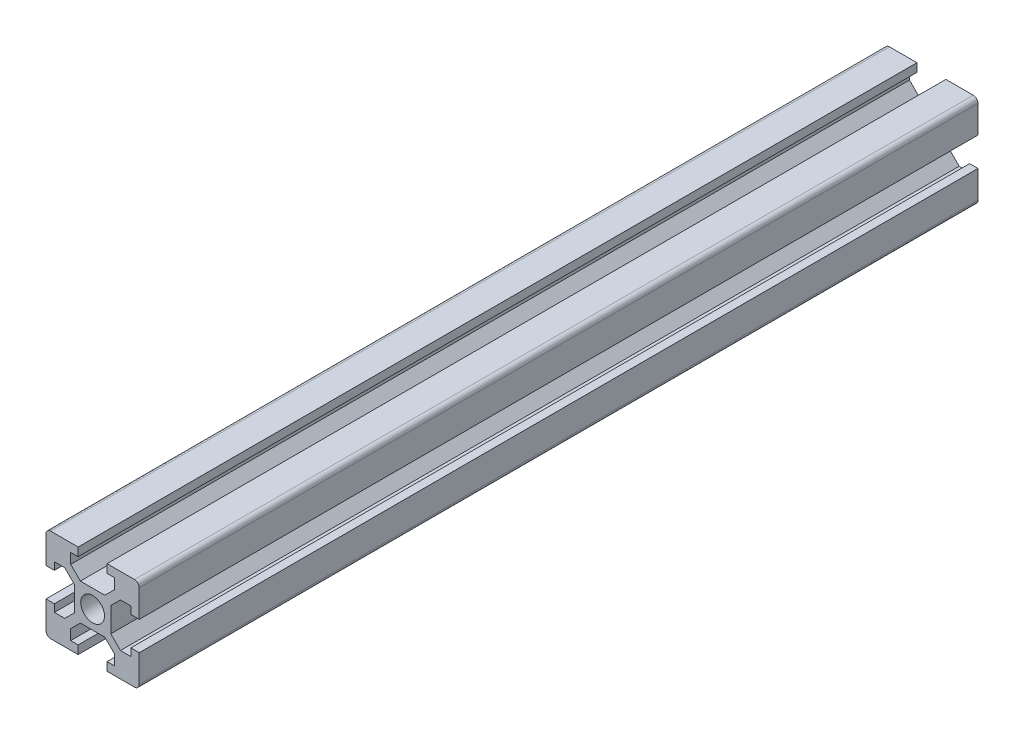
from build123d import *

# Parameters (mm, degrees)
SKETCH_1_R      = 2.55
EXTRUDE_1_DEPTH = 180
FILLET_1_R      = 1


with BuildPart() as part:
    # 草图1 → 凸台-拉伸1 (new body)
    with BuildSketch(Plane.XY):
        Polygon((4.62194142, 1.905266374), (6.694733626, 3.97805858), (6.694733626, 6.205266374), (5.094733626, 6.205266374), (5.094733626, 8.005266374), (11.994733626, 8.005266374), (11.994733626, 1.105266374), (10.194733626, 1.105266374), (10.194733626, 2.705266374), (7.967525833, 2.705266374), (5.894733626, 0.632474167), (5.894733626, -4.62194142), (7.967525833, -6.694733626), (10.194733626, -6.694733626), (10.194733626, -5.094733626), (11.994733626, -5.094733626), (11.994733626, -11.994733626), (5.094733626, -11.994733626), (5.094733626, -10.194733626), (6.694733626, -10.194733626), (6.694733626, -7.967525833), (4.62194142, -5.894733626), (-0.632474167, -5.894733626), (-2.705266374, -7.967525833), (-2.705266374, -10.194733626), (-1.105266374, -10.194733626), (-1.105266374, -11.994733626), (-8.005266374, -11.994733626), (-8.005266374, -5.094733626), (-6.205266374, -5.094733626), (-6.205266374, -6.694733626), (-3.97805858, -6.694733626), (-1.905266374, -4.62194142), (-1.905266374, 0.632474167), (-3.97805858, 2.705266374), (-6.205266374, 2.705266374), (-6.205266374, 1.105266374), (-8.005266374, 1.105266374), (-8.005266374, 8.005266374), (-1.105266374, 8.005266374), (-1.105266374, 6.205266374), (-2.705266374, 6.205266374), (-2.705266374, 3.97805858), (-0.632474167, 1.905266374), align=None)
        with Locations(Location((1.994733626, -1.994733626, 0), (0, 0, 180))):
            Circle(SKETCH_1_R, mode=Mode.SUBTRACT)
    extrude(amount=EXTRUDE_1_DEPTH)

    # 圆角1
    fillet_1_edges = [part.edges().sort_by_distance(p)[0] for p in [
        (-8.005266374, -11.994733626, 90),
        (-8.005266374, 8.005266374, 90),
        (11.994733626, 8.005266374, 90),
        (11.994733626, -11.994733626, 90),
    ]]
    fillet(fillet_1_edges, radius=FILLET_1_R)


solid = part.part
